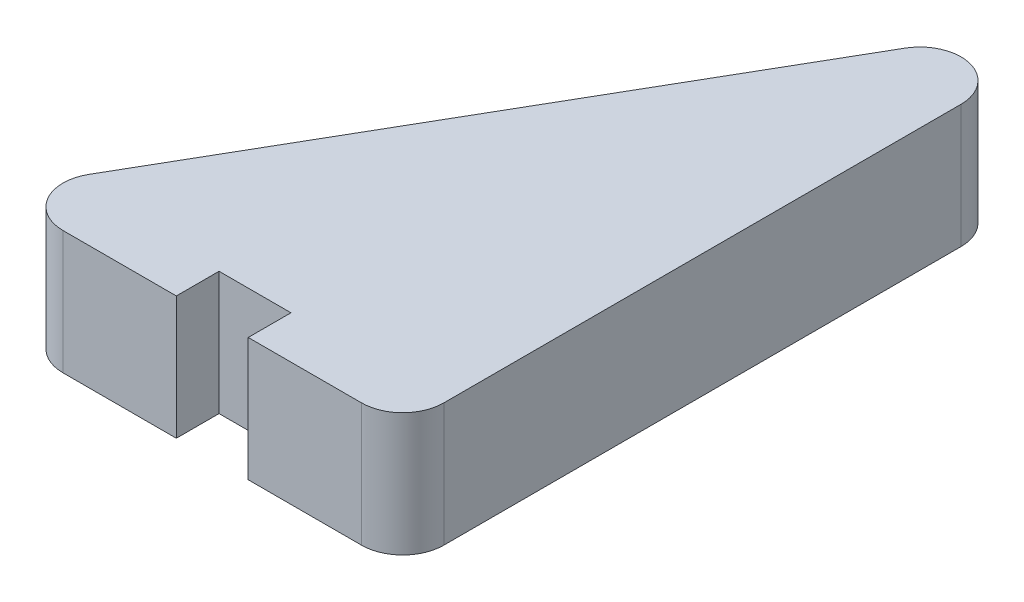
from build123d import *

# Parameters (mm, degrees)
BOSS_EXTRUDE1_DEPTH = 19.05
SKETCH2_W           = 11.1125
SKETCH2_H           = 6.604
CUT_EXTRUDE1_DEPTH  = 112.391012889


with BuildPart() as part:
    # Sketch1 → Boss-Extrude1 (new body)
    with BuildSketch(Plane(origin=(0, 0, 0), x_dir=(1, 0, 0), z_dir=(0, 1, 0))):
        with BuildLine():
            Line((0, 6.35), (0, 86.286703653))
            ThreePointArc((0, 86.286703653), (-4.706499064, 92.420332649), (-11.849261314, 89.461703653))
            Line((-11.849261314, 89.461703653), (-58.000738686, 9.525))
            ThreePointArc((-58.000738686, 9.525), (-58.000738686, 3.175), (-52.501477372, 0))
            Line((-52.501477372, 0), (-6.35, 0))
            ThreePointArc((-6.35, 0), (-1.859871939, 1.859871939), (0, 6.35))
        make_face()
    extrude(amount=BOSS_EXTRUDE1_DEPTH)

    # Sketch2 → Cut-Extrude1 (cut, through all)
    with BuildSketch(Plane(origin=(0, 19.05, 0), x_dir=(1, 0, 0), z_dir=(0, 1, 0))):
        with Locations((-29.425738686, 3.302)):
            Rectangle(SKETCH2_W, SKETCH2_H)
    extrude(amount=-CUT_EXTRUDE1_DEPTH, mode=Mode.SUBTRACT)


solid = part.part
